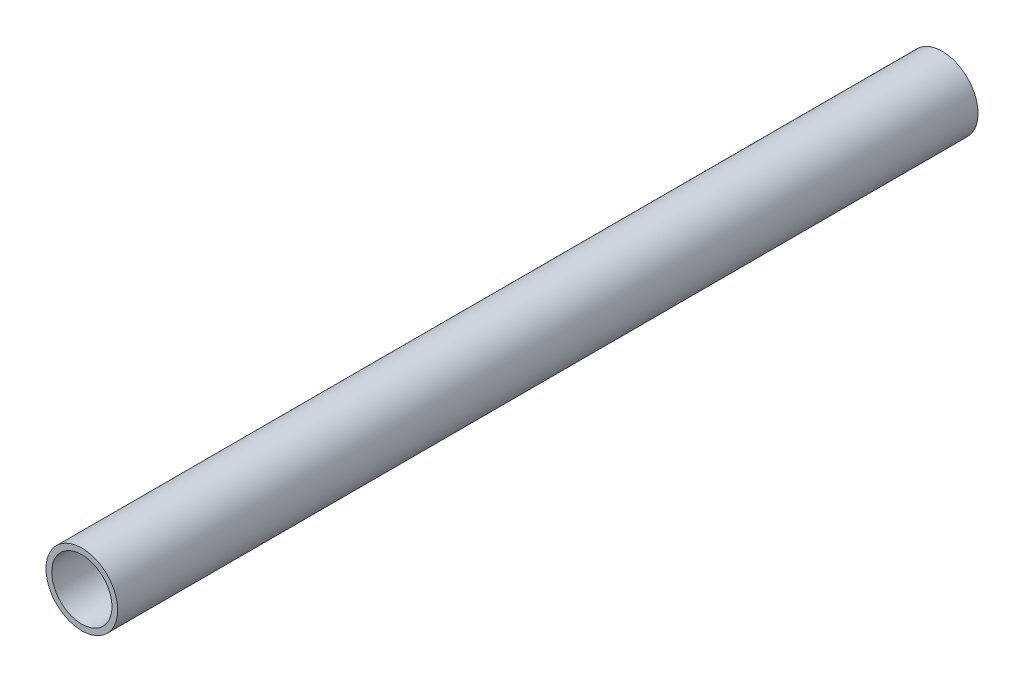
from build123d import *

# Parameters (mm, degrees)
SKETCH1_R           = 12.7
SKETCH1_R_2         = 10.668
BOSS_EXTRUDE1_DEPTH = 304.8


with BuildPart() as part:
    # Sketch1 → Boss-Extrude1 (new body)
    with BuildSketch(Plane.XY):
        with Locations(Location((0, 0, 0), (0, 0, 180))):
            Circle(SKETCH1_R)
        with Locations(Location((0, 0, 0), (0, 0, 180))):
            Circle(SKETCH1_R_2, mode=Mode.SUBTRACT)
    extrude(amount=BOSS_EXTRUDE1_DEPTH)


solid = part.part
